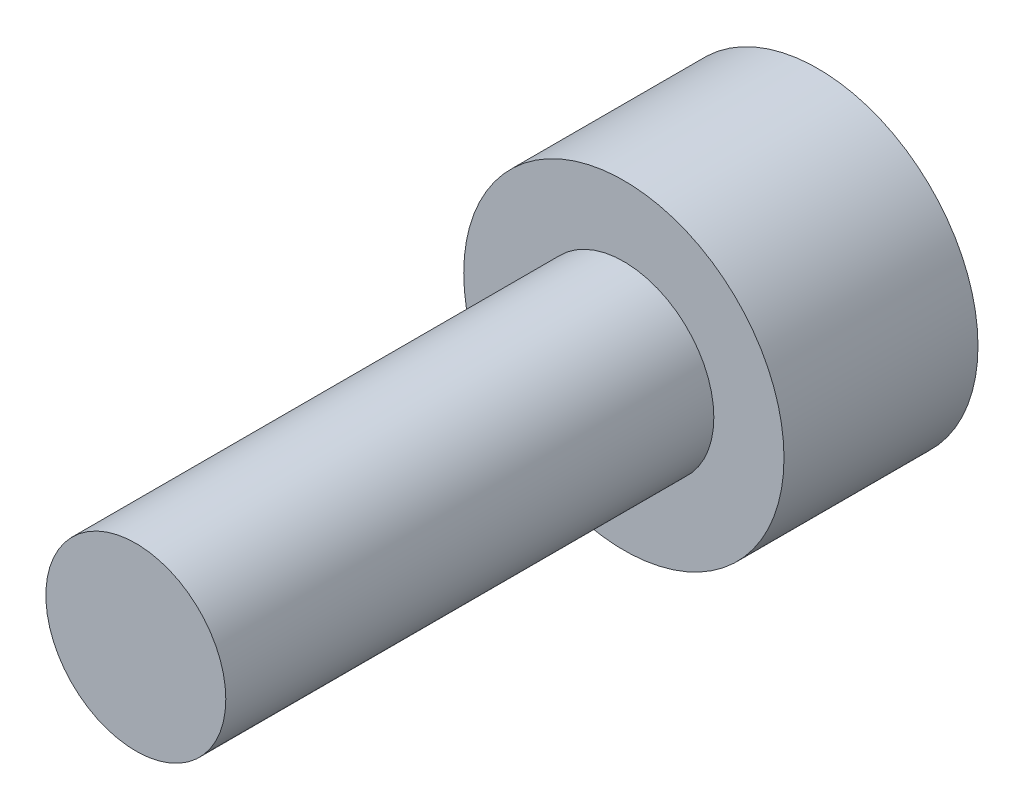
from build123d import *

# Parameters (mm, degrees)
SKETCH1_R           = 2.625
BOSS_EXTRUDE1_DEPTH = 3.18
SKETCH2_R           = 1.475
BOSS_EXTRUDE2_DEPTH = 8


with BuildPart() as part:
    # Sketch1 → Boss-Extrude1 (new body)
    with BuildSketch(Plane.XY):
        with Locations(Location((0, 0, 0), (0, 0, 180))):
            Circle(SKETCH1_R)
    extrude(amount=BOSS_EXTRUDE1_DEPTH)

    # Sketch2 → Boss-Extrude2 (add)
    with BuildSketch(Plane.XY.offset(3.18)):
        Circle(SKETCH2_R)
    extrude(amount=BOSS_EXTRUDE2_DEPTH)


solid = part.part
